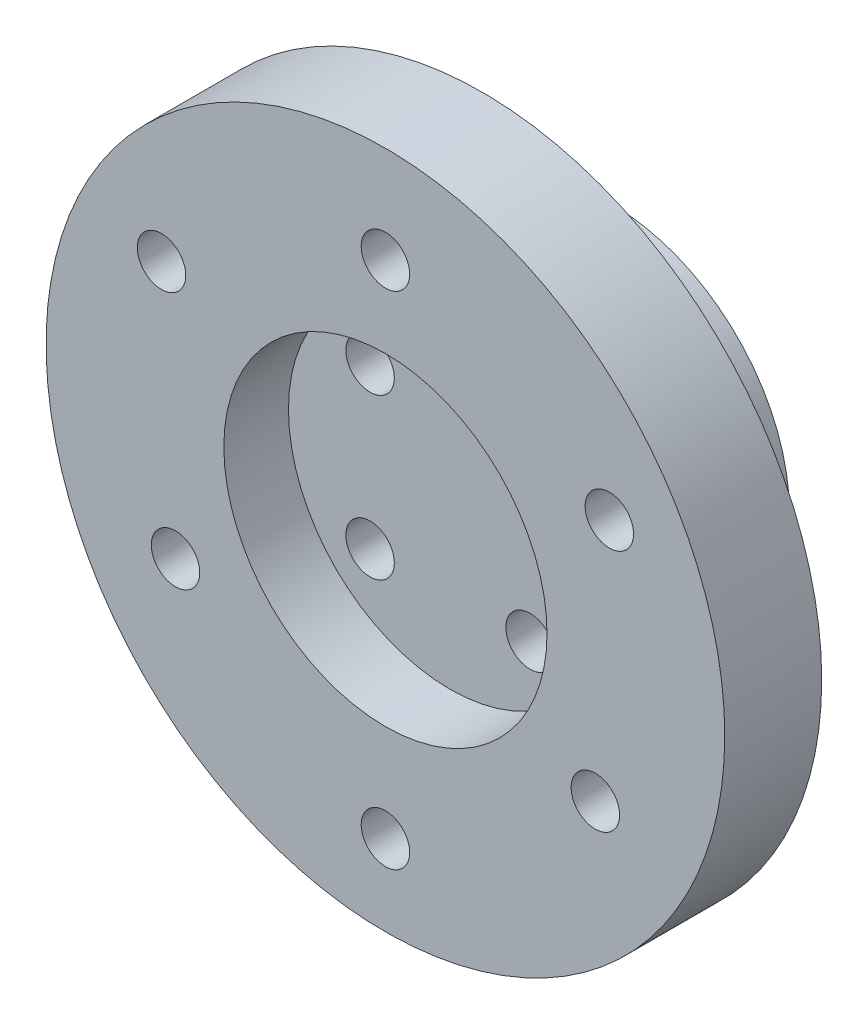
from build123d import *

# Parameters (mm, degrees)
SKETCH1_R           = 21
BOSS_EXTRUDE1_DEPTH = 6
SKETCH6_R           = 1.5
CUT_EXTRUDE2_DEPTH  = 6
SKETCH10_R          = 11
BOSS_EXTRUDE3_DEPTH = 8
SKETCH8_R           = 1.5
CUT_EXTRUDE3_DEPTH  = 10
SKETCH12_R          = 10
CUT_EXTRUDE5_DEPTH  = 4
SKETCH13_R          = 3.5
CUT_EXTRUDE6_DEPTH  = 2.5


with BuildPart() as part:
    # Sketch1 → Boss-Extrude1 (new body)
    with BuildSketch(Plane.XY):
        Circle(SKETCH1_R)
    extrude(amount=BOSS_EXTRUDE1_DEPTH)

    # Sketch6 → Cut-Extrude2 (cut)
    with BuildSketch(Plane(origin=(0, 0, 0), x_dir=(-1, 0, 0), z_dir=(0, 0, -1))):
        with Locations((0, 15)):
            Circle(SKETCH6_R)
        with Locations((12.990381057, -7.5)):
            Circle(SKETCH6_R)
        with Locations((-12.990381057, -7.5)):
            Circle(SKETCH6_R)
        with Locations((13.856406461, 8)):
            Circle(SKETCH6_R)
        with Locations((0, -16)):
            Circle(SKETCH6_R)
        with Locations((-13.856406461, 8)):
            Circle(SKETCH6_R)
    extrude(amount=-CUT_EXTRUDE2_DEPTH, mode=Mode.SUBTRACT)

    # Sketch10 → Boss-Extrude3 (add)
    with BuildSketch(Plane(origin=(0, 0, 0), x_dir=(-1, 0, 0), z_dir=(0, 0, -1))):
        with Locations(Location((0, 0, 0), (0, 0, 180))):
            Circle(SKETCH10_R)
    extrude(amount=BOSS_EXTRUDE3_DEPTH)

    # Sketch8 → Cut-Extrude3 (cut, symmetric)
    with BuildSketch(Plane(origin=(0, 0, 0), x_dir=(-1, 0, 0), z_dir=(0, 0, -1))):
        with Locations((-4.949747468, 4.949747468)):
            Circle(SKETCH8_R)
        with Locations((4.949747468, 4.949747468)):
            Circle(SKETCH8_R)
        with Locations((4.949747468, -4.949747468)):
            Circle(SKETCH8_R)
        with Locations((-4.949747468, -4.949747468)):
            Circle(SKETCH8_R)
    extrude(amount=CUT_EXTRUDE3_DEPTH, both=True, mode=Mode.SUBTRACT)

    # Sketch12 → Cut-Extrude5 (cut)
    with BuildSketch(Plane.XY.offset(6)):
        Circle(SKETCH12_R)
    extrude(amount=-CUT_EXTRUDE5_DEPTH, mode=Mode.SUBTRACT)

    # Sketch13 → Cut-Extrude6 (cut)
    with BuildSketch(Plane(origin=(0, 0, 0), x_dir=(-1, 0, 0), z_dir=(0, 0, -1))):
        with Locations((-13.856406461, 8)):
            Circle(SKETCH13_R)
        with Locations((13.856406461, 8)):
            Circle(SKETCH13_R)
        with Locations((0, -16)):
            Circle(SKETCH13_R)
    extrude(amount=-CUT_EXTRUDE6_DEPTH, mode=Mode.SUBTRACT)


solid = part.part
